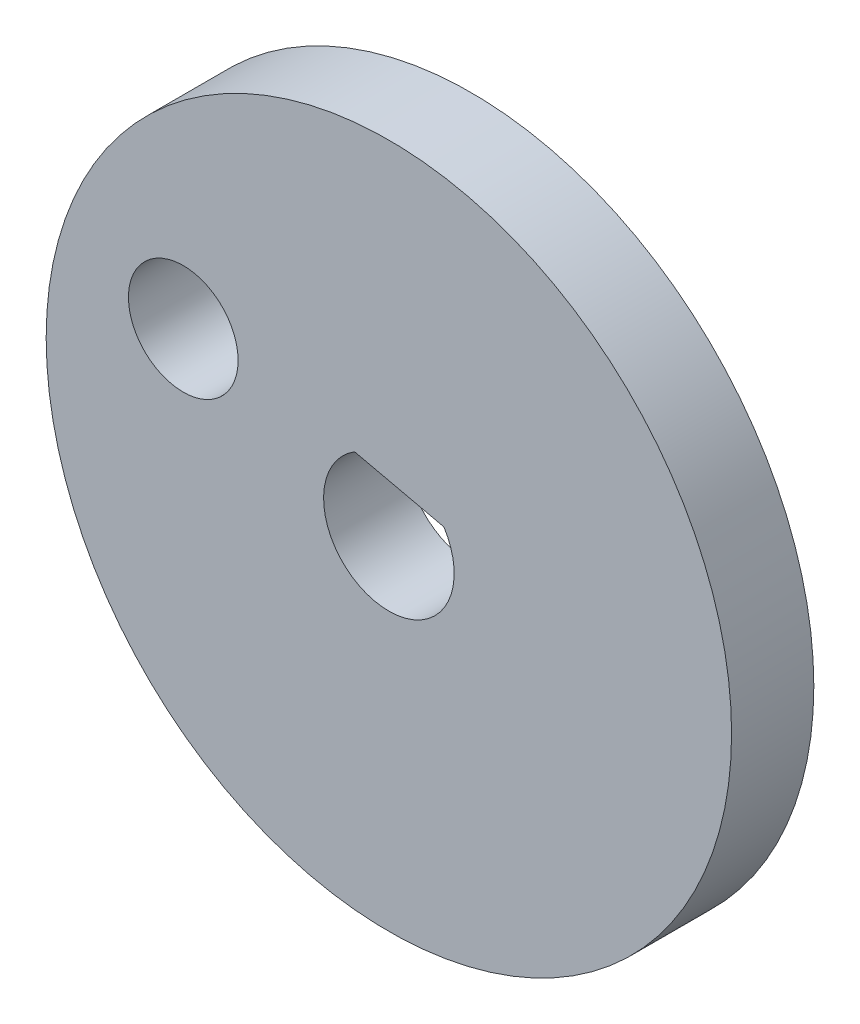
from build123d import *

# Parameters (mm, degrees)
SKETCH1_R           = 12.5
BOSS_EXTRUDE1_DEPTH = 3
CUT_EXTRUDE1_DEPTH  = 3
SKETCH3_R           = 2
CUT_EXTRUDE2_DEPTH  = 3


with BuildPart() as part:
    # Sketch1 → Boss-Extrude1 (new body)
    with BuildSketch(Plane.XY):
        Circle(SKETCH1_R)
    extrude(amount=BOSS_EXTRUDE1_DEPTH)

    # Sketch2 → Cut-Extrude1 (cut)
    with BuildSketch(Plane.XY.offset(3)):
        with BuildLine():
            Line((-1.249238699, 2.027252879), (2.006668261, 1.282042922))
            ThreePointArc((2.006668261, 1.282042922), (-0.531280863, -2.321226445), (-1.249238699, 2.027252879))
        make_face()
    extrude(amount=-CUT_EXTRUDE1_DEPTH, mode=Mode.SUBTRACT)

    # Sketch3 → Cut-Extrude2 (cut)
    with BuildSketch(Plane.XY.offset(3)):
        with Locations((-7.499150429, 2.786169925)):
            Circle(SKETCH3_R)
    extrude(amount=-CUT_EXTRUDE2_DEPTH, mode=Mode.SUBTRACT)


solid = part.part
